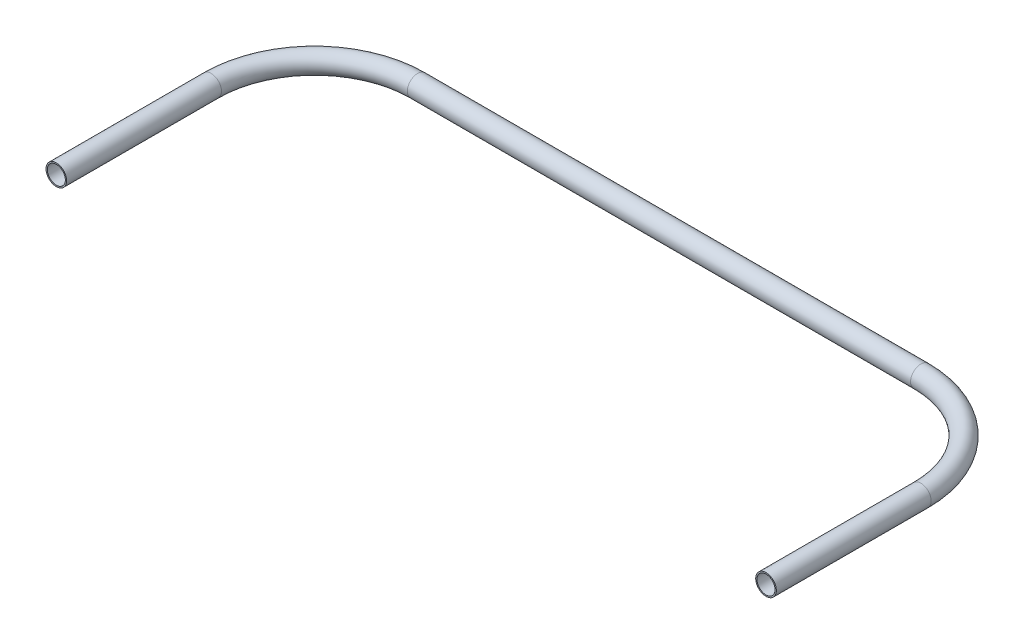
from build123d import *

# Parameters (mm, degrees)
SKETCH_2_R   = 8
SKETCH_2_R_2 = 7


with BuildPart() as part:
    # По траектории1: sweep along a path in Эскиз1
    with BuildLine(Plane(origin=(0, 0, 0), x_dir=(1, 0, 0), z_dir=(0, 1, 0))) as sweep_1_path:
        Line((-275, -200), (-275, -80))
        ThreePointArc((-275, -80), (-251.568542495, -23.431457505), (-195, 0))
        Line((-195, 0), (0, 0))
    # Эскиз2 → По траектории1 (sweep)
    with BuildSketch(Plane(origin=(0, 0, 0), x_dir=(0, 0, -1), z_dir=(1, 0, 0))):
        Circle(SKETCH_2_R)
        Circle(SKETCH_2_R_2, mode=Mode.SUBTRACT)
    sweep(path=sweep_1_path.line)

    # Зеркальное отражение1: part across plane


with BuildPart() as part_1:
    add(part.part)
    add(part.part.mirror(Plane(origin=(0, 0, 0), x_dir=(0, 0, 1), z_dir=(1, 0, 0))))


solid = part_1.part
